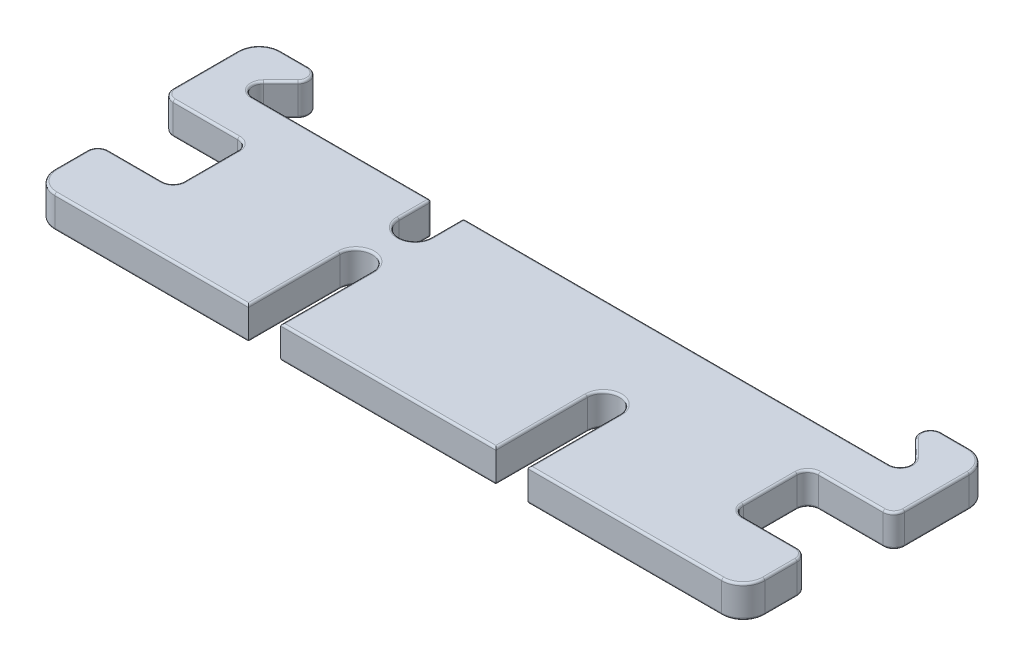
from build123d import *

# Parameters (mm, degrees)
BOSS_EXTRUDE1_DEPTH = 3
FILLET1_R           = 0.2


with BuildPart() as part:
    # Sketch1 → Boss-Extrude1 (new body)
    with BuildSketch(Plane(origin=(0, 0, 0), x_dir=(1, 0, 0), z_dir=(0, 1, 0))):
        with BuildLine():
            Line((10, 0), (-10, 0))
            Line((-10, 0), (-10, 8.5))
            ThreePointArc((-10, 8.5), (-11.5, 10), (-13, 8.5))
            Line((-13, 8.5), (-13, 0))
            Line((-13, 0), (-31, 0))
            ThreePointArc((-31, 0), (-32.414213562, 0.585786438), (-33, 2))
            Line((-33, 2), (-33, 5))
            ThreePointArc((-33, 5), (-32.707106781, 5.707106781), (-32, 6))
            Line((-32, 6), (-27, 6))
            ThreePointArc((-27, 6), (-26.292893219, 6.292893219), (-26, 7))
            Line((-26, 7), (-26, 12))
            ThreePointArc((-26, 12), (-26.292893219, 12.707106781), (-27, 13))
            Line((-27, 13), (-33, 13))
            ThreePointArc((-33, 13), (-33.707106781, 13.292893219), (-34, 14))
            Line((-34, 14), (-34, 20))
            ThreePointArc((-34, 20), (-33.414213562, 21.414213562), (-32, 22))
            Line((-32, 22), (-29.414213562, 22))
            ThreePointArc((-29.414213562, 22), (-28.49033403, 21.382683432), (-28.707106781, 20.292893219))
            Line((-28.707106781, 20.292893219), (-30.292893219, 18.707106781))
            ThreePointArc((-30.292893219, 18.707106781), (-30.50966597, 17.617316568), (-29.585786438, 17))
            Line((-29.585786438, 17), (-13, 17))
            Line((-13, 17), (-13, 14))
            ThreePointArc((-13, 14), (-11.5, 12.5), (-10, 14))
            Line((-10, 14), (-10, 17))
            Line((-10, 17), (29.585786438, 17))
            ThreePointArc((29.585786438, 17), (30.50966597, 17.617316568), (30.292893219, 18.707106781))
            Line((30.292893219, 18.707106781), (28.707106781, 20.292893219))
            ThreePointArc((28.707106781, 20.292893219), (28.49033403, 21.382683432), (29.414213562, 22))
            Line((29.414213562, 22), (32, 22))
            ThreePointArc((32, 22), (33.414213562, 21.414213562), (34, 20))
            Line((34, 20), (34, 14))
            ThreePointArc((34, 14), (33.707106781, 13.292893219), (33, 13))
            Line((33, 13), (27, 13))
            ThreePointArc((27, 13), (26.292893219, 12.707106781), (26, 12))
            Line((26, 12), (26, 7))
            ThreePointArc((26, 7), (26.292893219, 6.292893219), (27, 6))
            Line((27, 6), (32, 6))
            ThreePointArc((32, 6), (32.707106781, 5.707106781), (33, 5))
            Line((33, 5), (33, 2))
            ThreePointArc((33, 2), (32.414213562, 0.585786438), (31, 0))
            Line((31, 0), (13, 0))
            Line((13, 0), (13, 8.5))
            ThreePointArc((13, 8.5), (11.5, 10), (10, 8.5))
            Line((10, 8.5), (10, 0))
        make_face()
    extrude(amount=BOSS_EXTRUDE1_DEPTH)

    # Fillet1
    fillet1_edges = [part.edges().sort_by_distance(p)[0] for p in [
        (10, 3, -4.25),
        (-33.707106781, 3, -13.292893219),
        (-30, 3, -13),
        (-26.292893219, 3, -12.707106781),
        (-26, 3, -9.5),
        (-26.292893219, 3, -6.292893219),
        (-29.5, 3, -6),
        (-32.707106781, 3, -5.707106781),
        (-33, 3, -3.5),
        (-32.414213562, 3, -0.585786438),
        (-22, 3, 0),
        (11.5, 3, -10),
        (-13, 3, -4.25),
        (-11.5, 3, -10),
        (13, 3, -4.25),
        (22, 3, 0),
        (32.414213562, 3, -0.585786438),
        (33, 3, -3.5),
        (32.707106781, 3, -5.707106781),
        (29.5, 3, -6),
        (26.292893219, 3, -6.292893219),
        (-11.5, 0, -10),
        (-13, 0, -4.25),
        (26, 3, -9.5),
        (-22, 0, 0),
        (-32.414213562, 0, -0.585786438),
        (-33, 0, -3.5),
        (-32.707106781, 0, -5.707106781),
        (-29.5, 0, -6),
        (-26.292893219, 0, -6.292893219),
        (-26, 0, -9.5),
        (-10, 3, -4.25),
        (26.292893219, 3, -12.707106781),
        (-26.292893219, 0, -12.707106781),
        (-30, 0, -13),
        (-33.707106781, 0, -13.292893219),
        (-34, 0, -17),
        (-33.414213562, 0, -21.414213562),
        (-30.707106781, 0, -22),
        (-28.49033403, 0, -21.382683432),
        (-29.5, 0, -19.5),
        (30, 3, -13),
        (-30.50966597, 0, -17.617316568),
        (-21.292893219, 0, -17),
        (-13, 0, -15.5),
        (-11.5, 0, -12.5),
        (-10, 0, -15.5),
        (9.792893219, 0, -17),
        (30.50966597, 0, -17.617316568),
        (33.707106781, 3, -13.292893219),
        (29.5, 0, -19.5),
        (28.49033403, 0, -21.382683432),
        (30.707106781, 0, -22),
        (33.414213562, 0, -21.414213562),
        (34, 0, -17),
        (33.707106781, 0, -13.292893219),
        (30, 0, -13),
        (26.292893219, 0, -12.707106781),
        (34, 3, -17),
        (26, 0, -9.5),
        (26.292893219, 0, -6.292893219),
        (29.5, 0, -6),
        (32.707106781, 0, -5.707106781),
        (33, 0, -3.5),
        (32.414213562, 0, -0.585786438),
        (22, 0, 0),
        (33.414213562, 3, -21.414213562),
        (13, 0, -4.25),
        (11.5, 0, -10),
        (10, 0, -4.25),
        (0, 0, 0),
        (-10, 0, -4.25),
        (30.707106781, 3, -22),
        (28.49033403, 3, -21.382683432),
        (29.5, 3, -19.5),
        (30.50966597, 3, -17.617316568),
        (9.792893219, 3, -17),
        (-13, 1.5, -17),
        (-10, 1.5, -17),
        (0, 3, 0),
        (-10, 3, -15.5),
        (-11.5, 3, -12.5),
        (-13, 3, -15.5),
        (-21.292893219, 3, -17),
        (-30.50966597, 3, -17.617316568),
        (-29.5, 3, -19.5),
        (-28.49033403, 3, -21.382683432),
        (-30.707106781, 3, -22),
        (-33.414213562, 3, -21.414213562),
        (-34, 3, -17),
    ]]
    fillet(fillet1_edges, radius=FILLET1_R)


solid = part.part
